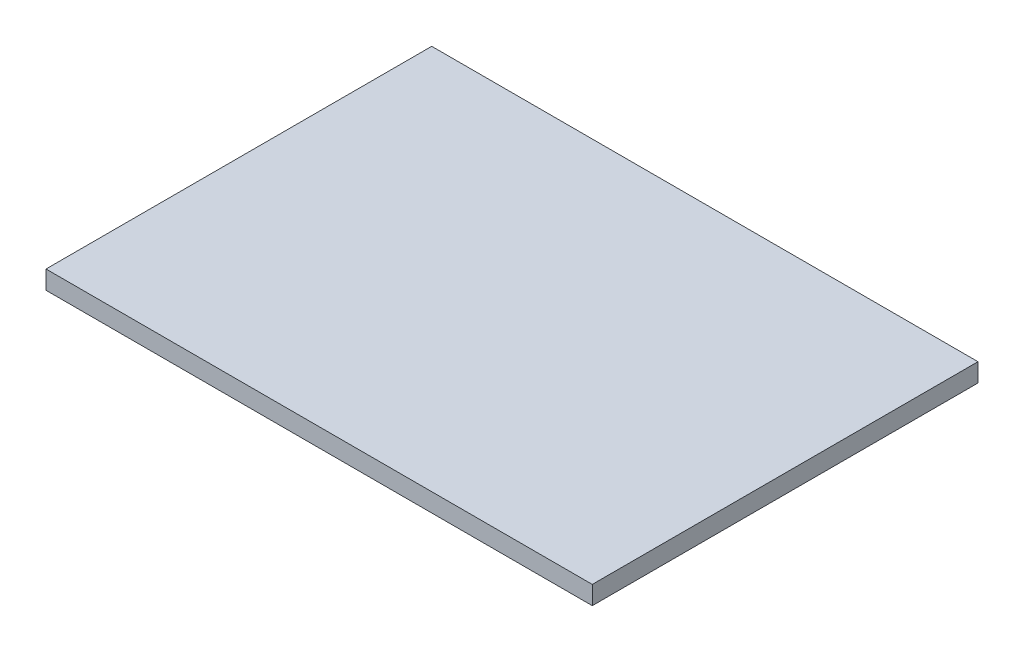
from build123d import *

# Parameters (mm, degrees)
SKETCH1_W      = 296
SKETCH1_H      = 209
EXTRUDE1_DEPTH = 10


with BuildPart() as part:
    # Sketch1 → Extrude1 (new body)
    with BuildSketch(Plane(origin=(0, 0, 0), x_dir=(1, 0, 0), z_dir=(0, 1, 0))):
        Rectangle(SKETCH1_W, SKETCH1_H)
    extrude(amount=EXTRUDE1_DEPTH)


solid = part.part
